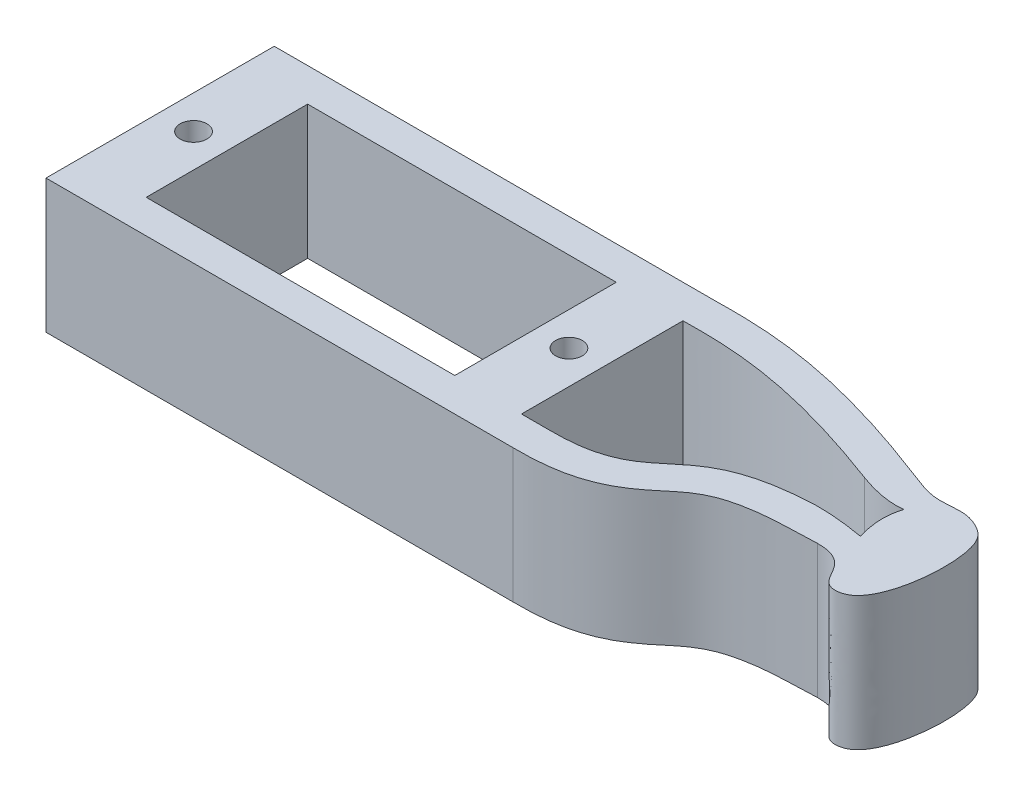
from build123d import *

# Parameters (mm, degrees)
SKETCH_1_R      = 1
SKETCH_1_W      = 23.1
SKETCH_1_H      = 12.085165135
EXTRUDE_1_DEPTH = 10


with BuildPart() as part:
    # Эскиз1 → Бобышка-Вытянуть1 (new body)
    with BuildSketch(Plane(origin=(0, 0, 0), x_dir=(1, 0, 0), z_dir=(0, 1, 0))):
        with BuildLine():
            Line((-2.5, 2.5), (28.070995288, 2.5))
            add(Edge.make_bspline(
                [(28.070995288, 2.5), (28.32887344, 2.504318085), (28.835562657, 2.511245965), (29.921866616, 2.512119229), (31.964225284, 2.457517191), (34.707115979, 2.168731474), (37.997362638, 1.485873867), (40.79387565, 0.734966307), (43.953396938, -0.279779406), (46.385663882, -1.195748574), (47.557228164, -1.634125111)],
                knots=[0.143669129, 0.143669129, 0.143669129, 0.143669129, 0.200446635, 0.257224141, 0.370779153, 0.597889176, 0.711444188, 0.824999199, 0.938554211, 1.052109223, 1.052109223, 1.052109223, 1.052109223], degree=3))
            add(Edge.make_bspline(
                [(47.557228164, -1.634125111), (49.83999595, -2.578486337), (50.790555246, -1.175830705), (54.350201844, -3.715245794), (53.810633179, -11.510937101), (49.614910749, -12.021962191), (50.244612096, -9.357273045), (47.557228164, -9.390885833)],
                knots=[0, 0, 0, 0, 0.410599119, 0.487696402, 0.739497672, 0.793875548, 1, 1, 1, 1], degree=3))
            add(Edge.make_bspline(
                [(47.557228164, -9.390885833), (47.223512443, -9.403598686), (46.55537249, -9.42886967), (45.723740105, -9.461231999), (45.050994829, -9.485497305), (44.475367741, -9.514158988), (43.520556703, -9.588873607), (42.395821116, -9.749897974), (40.99972022, -10.09133704), (39.888015817, -10.595512334), (38.900584218, -11.310794918), (37.710783689, -12.364152312), (36.207778756, -13.39563326), (34.630627358, -14.030201283), (33.281126924, -14.37048255), (32.003062284, -14.531692535), (30.884799393, -14.587163413), (30.266883356, -14.58983575), (29.965322631, -14.585165135)],
                knots=[0.000757075, 0.000757075, 0.000757075, 0.000757075, 0.034517651, 0.068278226, 0.085158513, 0.102038801, 0.135799376, 0.203320526, 0.270841676, 0.405883976, 0.540926277, 0.675968577, 0.811010877, 0.878532027, 0.946053178, 1.013574328, 1.047334903, 1.081095478, 1.081095478, 1.081095478, 1.081095478], degree=3))
            Line((29.965322631, -14.585165135), (-2.5, -14.585165135))
            Line((-2.5, -14.585165135), (-5, -14.585165135))
            Line((-5, -14.585165135), (-5, 2.5))
            Line((-5, 2.5), (-2.5, 2.5))
        make_face()
        with Locations(Location((-2.5, -6.042582568, 0), (0, 0, 270))):
            Circle(SKETCH_1_R, mode=Mode.SUBTRACT)
        with Locations(Location((25.600001017, -6.042548927, 0), (0, 0, 270))):
            Circle(SKETCH_1_R, mode=Mode.SUBTRACT)
        with Locations((11.55, -6.042582568)):
            Rectangle(SKETCH_1_W, SKETCH_1_H, mode=Mode.SUBTRACT)
        with BuildLine():
            Line((28.092032276, -12.085165135), (29.985216163, -12.085165135))
            add(Edge.make_bspline(
                [(29.985216163, -12.085165135), (38.281074708, -12.220944361), (35.172452203, -7.360868715), (45.057228164, -6.984309607)],
                knots=[0, 0, 0, 0, 1, 1, 1, 1], degree=3))
            add(Edge.make_bspline(
                [(45.057228164, -6.984309607), (46.59616868, -6.960661023), (48.710327015, -7.325766452)],
                knots=[0, 0, 0, 1, 1, 1], degree=2))
            add(Edge.make_bspline(
                [(48.710327015, -7.325766452), (48.345253613, -6.197571714), (48.243086622, -5.009541806), (48.597312625, -3.963116498)],
                knots=[0, 0, 0, 0, 1, 1, 1, 1], degree=3))
            add(Edge.make_bspline(
                [(45.057228164, -3.367956317), (47.181075152, -4.141830426), (48.597312625, -3.963116498)],
                knots=[0, 0, 0, 1, 1, 1], degree=2))
            add(Edge.make_bspline(
                [(28.092032276, 0), (31.819034224, 0.063049174), (36.14539206, -0.033320809), (45.057228164, -3.367956317)],
                knots=[0.142072164, 0.142072164, 0.142072164, 0.142072164, 1, 1, 1, 1], degree=3))
            Line((28.092032276, 0), (28.092032276, -12.085165135))
        make_face(mode=Mode.SUBTRACT)
    extrude(amount=EXTRUDE_1_DEPTH)


solid = part.part
